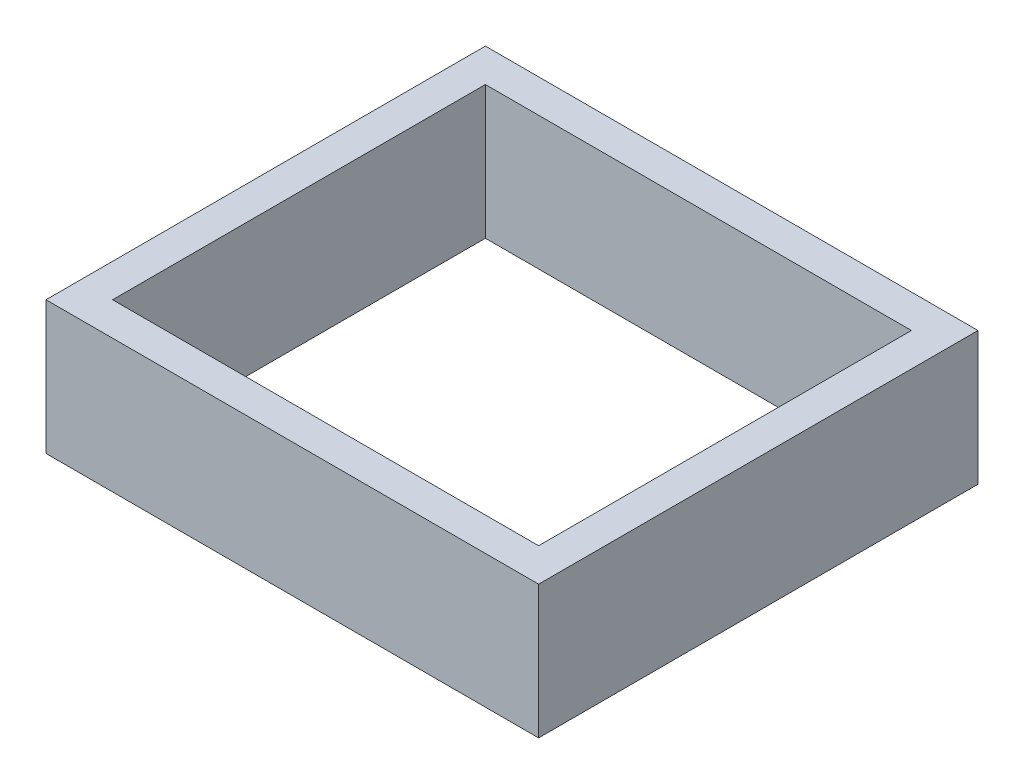
from build123d import *

# Parameters (mm, degrees)
IZIM1_W                     = 74
IZIM1_H                     = 66
IZIM1_W_2                   = 64
IZIM1_H_2                   = 56
Y_KSEKLIK_EKSTR_ZYON1_DEPTH = 20


with BuildPart() as part:
    # Çizim1 → Yükseklik-Ekstrüzyon1 (new body)
    with BuildSketch(Plane(origin=(0, 0, 0), x_dir=(1, 0, 0), z_dir=(0, 1, 0))):
        with Locations((37, 33)):
            Rectangle(IZIM1_W, IZIM1_H)
        with Locations((37, 33)):
            Rectangle(IZIM1_W_2, IZIM1_H_2, mode=Mode.SUBTRACT)
    extrude(amount=Y_KSEKLIK_EKSTR_ZYON1_DEPTH)


solid = part.part
